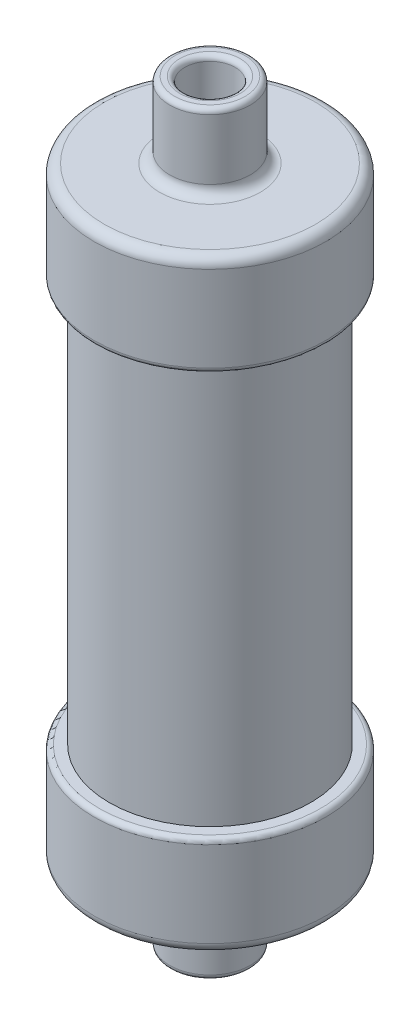
from build123d import *

# Parameters (mm, degrees)
EXTRUIR_L_MINA1_DEPTH      = 50
EXTRUIR_L_MINA1_DEPTH_BACK = 50
CROQUIS1_R                 = 20
CROQUIS1_R_2               = 17
CROQUIS2_R                 = 23
CROQUIS2_R_2               = 20
EXTRUIR1_DEPTH             = 10
CROQUIS3_R                 = 23
EXTRUIR2_DEPTH             = 10
CROQUIS4_R                 = 8
CROQUIS4_R_2               = 5
EXTRUIR3_DEPTH             = 15
CROQUIS5_R                 = 5
EXTRUIR4_DEPTH             = 20
REDONDEO1_R                = 2
REDONDEO2_R                = 1


with BuildPart() as part:
    # Croquis1 → Extruir-Lámina1 (new, two sides: drawn at the far end of the back side and taken through both)
    with BuildSketch(Plane(origin=(0, 0, 0), x_dir=(1, 0, 0), z_dir=(0, 1, 0)).offset(-EXTRUIR_L_MINA1_DEPTH_BACK)):
        Circle(CROQUIS1_R)
        Circle(CROQUIS1_R_2, mode=Mode.SUBTRACT)
    extrude(amount=EXTRUIR_L_MINA1_DEPTH + EXTRUIR_L_MINA1_DEPTH_BACK)


with BuildPart() as body_2:
    # Croquis2 → Extruir1 (new body)
    with BuildSketch(Plane(origin=(0, 50, 0), x_dir=(1, 0, 0), z_dir=(0, 1, 0))):
        with Locations(Location((0, 0, 0), (0, 0, 270))):
            Circle(CROQUIS2_R)
        with Locations(Location((0, 0, 0), (0, 0, 270))):
            Circle(CROQUIS2_R_2, mode=Mode.SUBTRACT)
    extrude(amount=-EXTRUIR1_DEPTH)

    # Croquis3 → Extruir2 (add)
    with BuildSketch(Plane(origin=(0, 50, 0), x_dir=(1, 0, 0), z_dir=(0, 1, 0))):
        with Locations(Location((0, 0, 0), (0, 0, 270))):
            Circle(CROQUIS3_R)
    extrude(amount=EXTRUIR2_DEPTH)

    # Croquis4 → Extruir3 (add)
    with BuildSketch(Plane(origin=(0, 60, 0), x_dir=(1, 0, 0), z_dir=(0, 1, 0))):
        with Locations(Location((0, 0, 0), (0, 0, 270))):
            Circle(CROQUIS4_R)
        with Locations(Location((0, 0, 0), (0, 0, 270))):
            Circle(CROQUIS4_R_2, mode=Mode.SUBTRACT)
    extrude(amount=EXTRUIR3_DEPTH)

    # Croquis5 → Extruir4 (cut)
    with BuildSketch(Plane(origin=(0, 60, 0), x_dir=(1, 0, 0), z_dir=(0, 1, 0))):
        with Locations(Location((0, 0, 0), (0, 0, 270))):
            Circle(CROQUIS5_R)
    extrude(amount=-EXTRUIR4_DEPTH, mode=Mode.SUBTRACT)

    # Redondeo1
    redondeo1_edges = [body_2.edges().sort_by_distance(p)[0] for p in [
        (0, 60, -23),
        (0, 60, -8),
    ]]
    fillet(redondeo1_edges, radius=REDONDEO1_R)

    # Redondeo2
    redondeo2_edges = [body_2.edges().sort_by_distance(p)[0] for p in [
        (0, 75, -8),
        (0, 75, -5),
        (0, 40, -23),
    ]]
    fillet(redondeo2_edges, radius=REDONDEO2_R)


with BuildPart() as body_3:
    # Simetría1: mirrored copy
    add(body_2.part.mirror(Plane.ZX))


solid = Compound([part.part, body_2.part, body_3.part])
